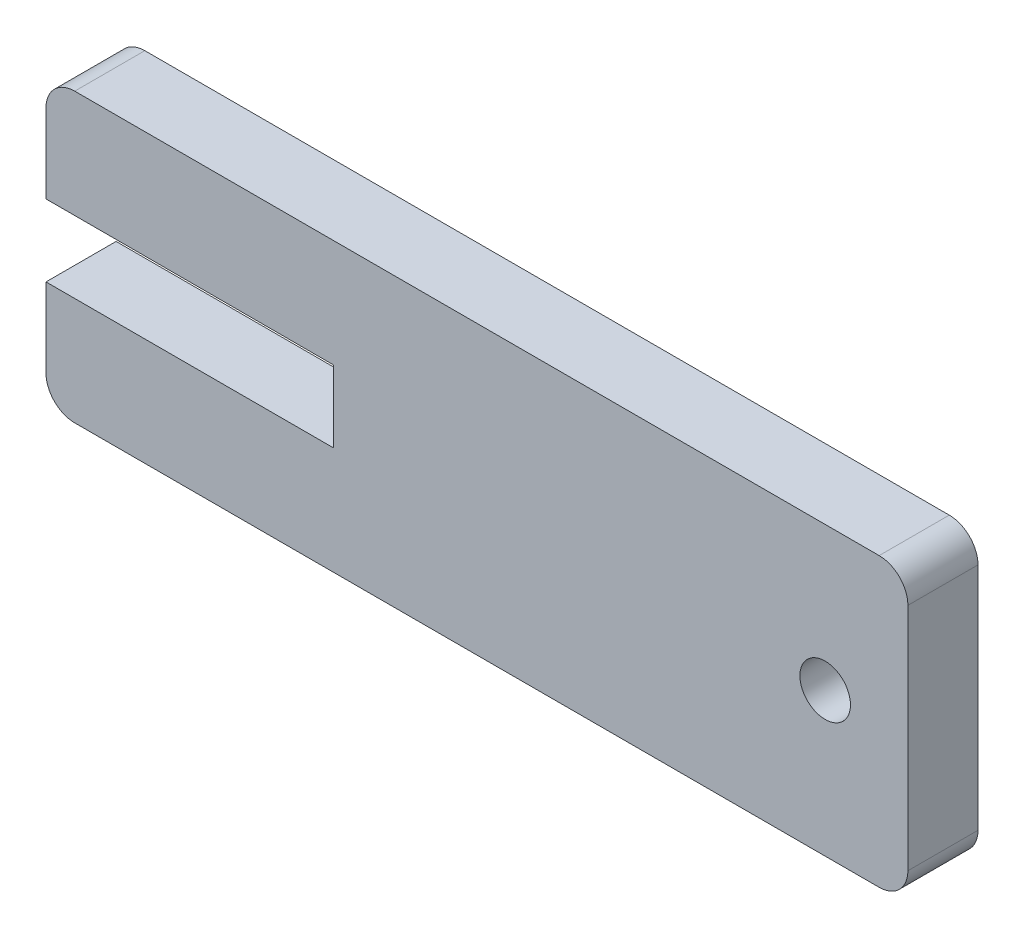
from build123d import *

# Parameters (mm, degrees)
BOSS_EXTRUDE1_DEPTH = 1.5494
FILLET1_R           = 1.27
SKETCH2_R           = 1.1176
CUT_EXTRUDE1_DEPTH  = 27.364465886


with BuildPart() as part:
    # Sketch1 → Boss-Extrude1 (new, symmetric)
    with BuildSketch(Plane.XY):
        Polygon((-12.7, 1.5875), (-12.7, 6.35), (25.4, 6.35), (25.4, -6.35), (-12.7, -6.35), (-12.7, -1.5875), (0, -1.5875), (0, 1.5875), align=None)
    extrude(amount=BOSS_EXTRUDE1_DEPTH, both=True)

    # Fillet1
    fillet1_edges = [part.edges().sort_by_distance(p)[0] for p in [
        (-12.7, 6.35, 0),
        (25.4, 6.35, 0),
        (25.4, -6.35, 0),
        (-12.7, -6.35, 0),
    ]]
    fillet(fillet1_edges, radius=FILLET1_R)

    # Sketch2 → Cut-Extrude1 (cut, through all)
    with BuildSketch(Plane.XY.offset(1.5494)):
        with Locations((21.7424, 0)):
            Circle(SKETCH2_R)
    extrude(amount=-CUT_EXTRUDE1_DEPTH, mode=Mode.SUBTRACT)


solid = part.part
